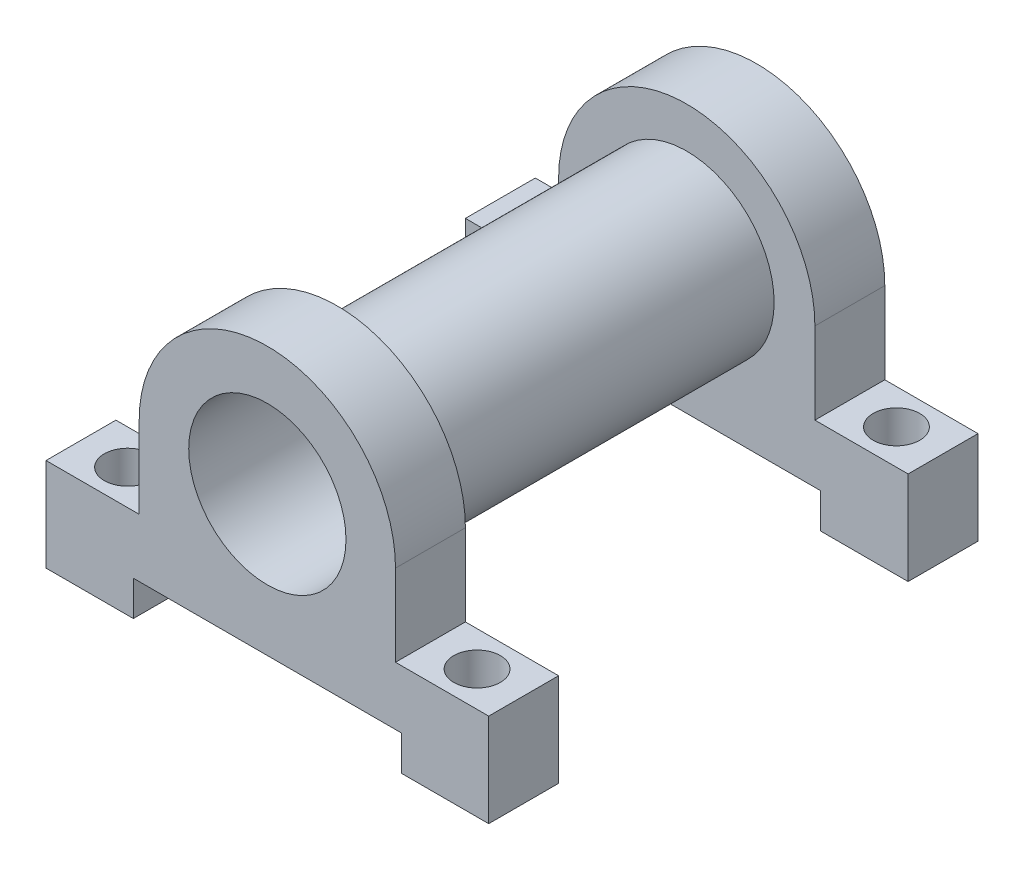
from build123d import *

# Parameters (mm, degrees)
BOSS_EXTRUDE1_DEPTH     = 6
SKETCH2_R               = 7.5
BOSS_EXTRUDE2_DEPTH     = 30
BOSS_EXTRUDE3_DEPTH     = 6
SKETCH4_R               = 6.75
CUT_EXTRUDE1_DEPTH      = 49.476798574
CUT_EXTRUDE2_DEPTH      = 49.476798574
CUT_EXTRUDE2_DEPTH_BACK = 49.476798574
SKETCH5_W               = 23
SKETCH5_H               = 3
SKETCH6_R               = 2
CUT_EXTRUDE3_DEPTH      = 50.487372127


with BuildPart() as part:
    # Sketch1 → Boss-Extrude1 (new body)
    with BuildSketch(Plane.XY):
        with BuildLine():
            Line((-11, 0), (-11, -7))
            Line((-11, -7), (-19, -7))
            Line((-19, -7), (-19, -15))
            Line((-19, -15), (-11, -15))
            Line((-11, -15), (11, -15))
            Line((11, -15), (19, -15))
            Line((19, -15), (19, -7))
            Line((19, -7), (11, -7))
            Line((11, -7), (11, 0))
            ThreePointArc((11, 0), (0, 11), (-11, 0))
        make_face()
    extrude(amount=BOSS_EXTRUDE1_DEPTH)

    # Sketch2 → Boss-Extrude2 (add)
    with BuildSketch(Plane.XY.offset(6)):
        Circle(SKETCH2_R)
    extrude(amount=BOSS_EXTRUDE2_DEPTH)

    # Sketch3 → Boss-Extrude3 (add)
    with BuildSketch(Plane.XY.offset(36)):
        with BuildLine():
            Line((-11, 0), (-11, -7))
            Line((-11, -7), (-19, -7))
            Line((-19, -7), (-19, -15))
            Line((-19, -15), (19, -15))
            Line((19, -15), (19, -7))
            Line((19, -7), (11, -7))
            Line((11, -7), (11, 0))
            ThreePointArc((11, 0), (0, 11), (-11, 0))
        make_face()
    extrude(amount=BOSS_EXTRUDE3_DEPTH)

    # Sketch4 → Cut-Extrude1 (cut, through all)
    with BuildSketch(Plane.XY.offset(42)):
        Circle(SKETCH4_R)
    extrude(amount=-CUT_EXTRUDE1_DEPTH, mode=Mode.SUBTRACT)

    # Sketch5 → Cut-Extrude2 (cut, two sides: drawn at the far end of the back side and taken through both)
    with BuildSketch(Plane(origin=(0, 0, 0), x_dir=(-1, 0, 0), z_dir=(0, 0, -1)).offset(-CUT_EXTRUDE2_DEPTH_BACK)):
        with Locations((0, -13.5)):
            Rectangle(SKETCH5_W, SKETCH5_H)
    extrude(amount=CUT_EXTRUDE2_DEPTH + CUT_EXTRUDE2_DEPTH_BACK, mode=Mode.SUBTRACT)

    # Sketch6 → Cut-Extrude3 (cut, through all)
    with BuildSketch(Plane(origin=(0, -7, 0), x_dir=(1, 0, 0), z_dir=(0, 1, 0))):
        with Locations(Location((-15, -3, 0), (0, 0, 270))):
            Circle(SKETCH6_R)
        with Locations(Location((15, -3, 0), (0, 0, 270))):
            Circle(SKETCH6_R)
        with Locations(Location((15, -39, 0), (0, 0, 270))):
            Circle(SKETCH6_R)
        with Locations(Location((-15, -39, 0), (0, 0, 270))):
            Circle(SKETCH6_R)
    extrude(amount=-CUT_EXTRUDE3_DEPTH, mode=Mode.SUBTRACT)


solid = part.part
